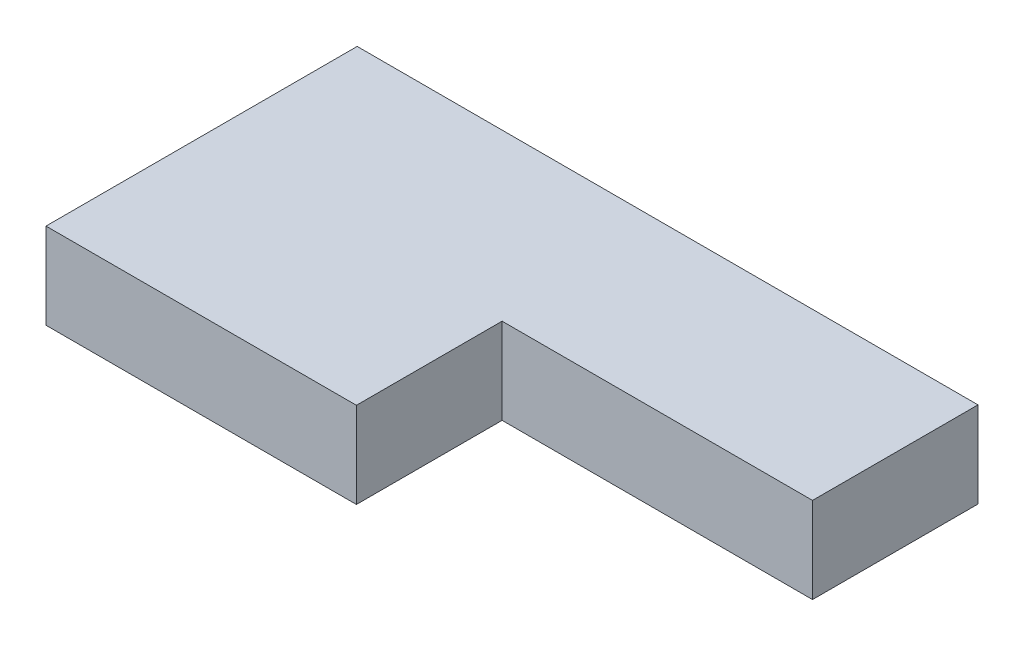
from build123d import *

# Parameters (mm, degrees)
EXTRUDE1_DEPTH = 12.7


with BuildPart() as part:
    # Sketch1 → Extrude1 (new body)
    with BuildSketch(Plane(origin=(0, 0, 0), x_dir=(1, 0, 0), z_dir=(0, 1, 0))):
        Polygon((0, 40.680665025), (91.77094371, 40.680665025), (91.77094371, 16.21908867), (45.885471855, 16.21908867), (45.885471855, -5.31773399), (0, -5.31773399), align=None)
    extrude(amount=-EXTRUDE1_DEPTH)


solid = part.part
